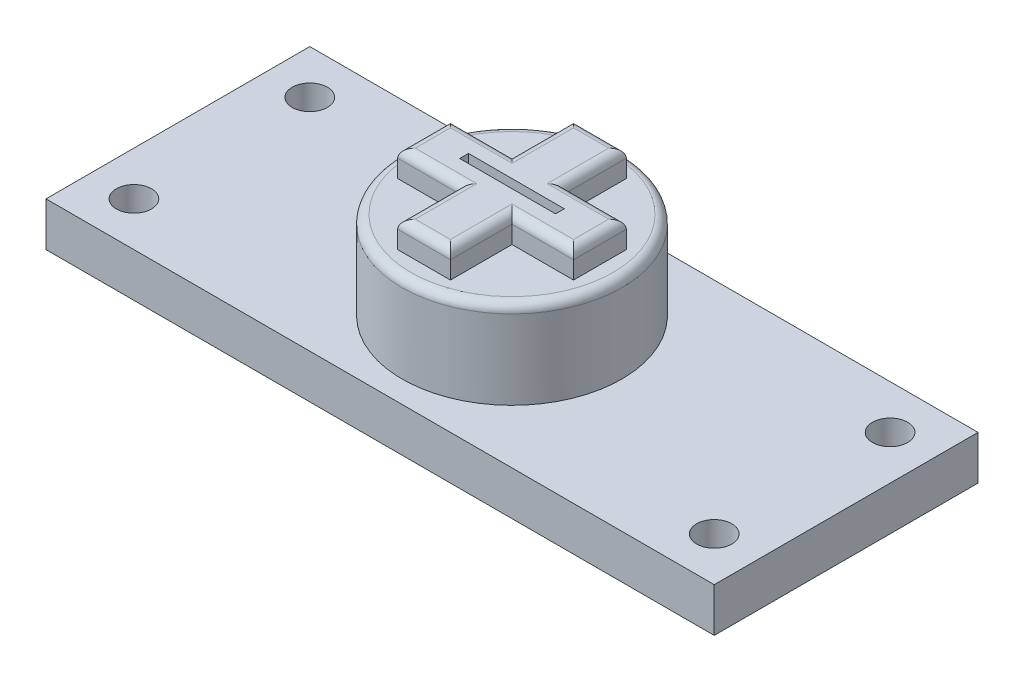
from build123d import *

# Parameters (mm, degrees)
SKETCH1_W           = 7600
SKETCH1_H           = 3000
BOSS_EXTRUDE1_DEPTH = 500
SKETCH2_R           = 200
CUT_EXTRUDE1_DEPTH  = 1000
SKETCH3_R           = 1250
BOSS_EXTRUDE2_DEPTH = 1000
BOSS_EXTRUDE3_DEPTH = 300
FILLET1_R           = 100
FILLET2_R           = 100
SKETCH6_W           = 1090.5
SKETCH6_H           = 100
CUT_EXTRUDE2_DEPTH  = 100


with BuildPart() as part:
    # Sketch1 → Boss-Extrude1 (new body)
    with BuildSketch(Plane(origin=(0, 0, 0), x_dir=(1, 0, 0), z_dir=(0, 1, 0))):
        Rectangle(SKETCH1_W, SKETCH1_H)
    extrude(amount=BOSS_EXTRUDE1_DEPTH)

    # Sketch2 → Cut-Extrude1 (cut)
    with BuildSketch(Plane(origin=(0, 500, 0), x_dir=(1, 0, 0), z_dir=(0, 1, 0))):
        with Locations(Location((-3300, -1000, 0), (0, 0, 270))):
            Circle(SKETCH2_R)
        with Locations(Location((-3300, 1000, 0), (0, 0, 270))):
            Circle(SKETCH2_R)
        with Locations(Location((3300, 1000, 0), (0, 0, 270))):
            Circle(SKETCH2_R)
        with Locations(Location((3300, -1000, 0), (0, 0, 270))):
            Circle(SKETCH2_R)
    extrude(amount=-CUT_EXTRUDE1_DEPTH, mode=Mode.SUBTRACT)

    # Sketch3 → Boss-Extrude2 (add)
    with BuildSketch(Plane(origin=(0, 500, 0), x_dir=(1, 0, 0), z_dir=(0, 1, 0))):
        with Locations(Location((0, 0, 0), (0, 0, 90))):
            Circle(SKETCH3_R)
    extrude(amount=BOSS_EXTRUDE2_DEPTH)

    # Sketch4 → Boss-Extrude3 (add)
    with BuildSketch(Plane(origin=(0, 1500, 0), x_dir=(1, 0, 0), z_dir=(0, 1, 0))):
        Polygon((-300, -300), (-300, -1000), (300, -1000), (300, -300), (1000, -300), (1000, 300), (300, 300), (300, 1000), (-300, 1000), (-300, 300), (-1000, 300), (-1000, -300), align=None)
    extrude(amount=BOSS_EXTRUDE3_DEPTH)

    # Fillet1
    fillet1_edges = [part.edges().sort_by_distance(p)[0] for p in [
        (300, 1800, 650),
        (650, 1800, 300),
        (1000, 1800, 0),
        (650, 1800, -300),
        (300, 1800, -650),
        (0, 1800, -1000),
        (-300, 1800, -650),
        (-650, 1800, -300),
        (-1000, 1800, 0),
        (-650, 1800, 300),
        (-300, 1800, 650),
        (0, 1800, 1000),
    ]]
    fillet(fillet1_edges, radius=FILLET1_R)

    # Fillet2
    fillet2_edges = [part.edges().sort_by_distance(p)[0] for p in [
        (0, 1500, 1250),
    ]]
    fillet(fillet2_edges, radius=FILLET2_R)

    # Sketch6 → Cut-Extrude2 (cut)
    with BuildSketch(Plane(origin=(0, 1800, 0), x_dir=(1, 0, 0), z_dir=(0, 1, 0))):
        Rectangle(SKETCH6_W, SKETCH6_H)
    extrude(amount=-CUT_EXTRUDE2_DEPTH, mode=Mode.SUBTRACT)


solid = part.part
